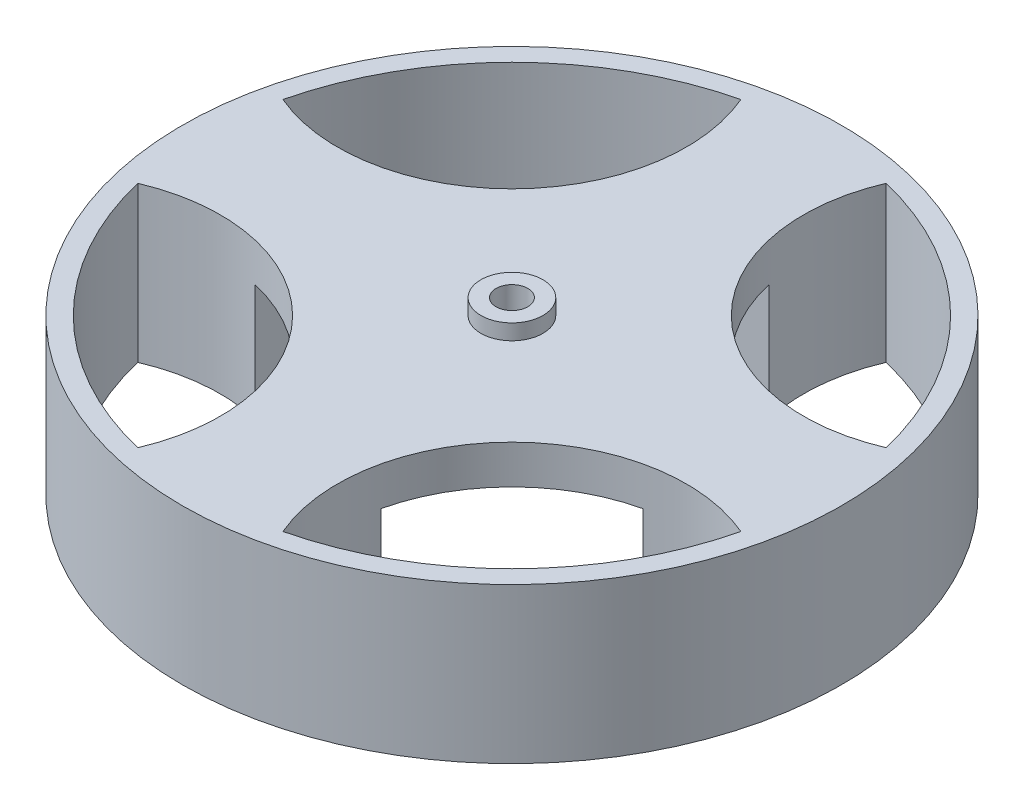
from build123d import *

# Parameters (mm, degrees)
SKETCH1_R           = 42.5
SKETCH1_R_2         = 40
BOSS_EXTRUDE1_DEPTH = 10
BOSS_EXTRUDE2_START = -5
BOSS_EXTRUDE2_DEPTH = 5
SKETCH3_R           = 4
SKETCH3_R_2         = 2.05
BOSS_EXTRUDE3_DEPTH = 2
SKETCH4_R           = 2.05
CUT_EXTRUDE1_DEPTH  = 64.344297297
BOSS_EXTRUDE4_START = 15
BOSS_EXTRUDE4_DEPTH = 15


with BuildPart() as part:
    # Sketch1 → Boss-Extrude1 (new, symmetric)
    with BuildSketch(Plane(origin=(0, 0, 0), x_dir=(1, 0, 0), z_dir=(0, 1, 0))):
        with Locations(Location((0, 0, 0), (0, 0, 270))):
            Circle(SKETCH1_R)
        with Locations(Location((0, 0, 0), (0, 0, 270))):
            Circle(SKETCH1_R_2, mode=Mode.SUBTRACT)
    extrude(amount=BOSS_EXTRUDE1_DEPTH, both=True)

    # Sketch2 → Boss-Extrude2 (add)
    with BuildSketch(Plane(origin=(0, 10, 0), x_dir=(1, 0, 0), z_dir=(0, 1, 0)).offset(BOSS_EXTRUDE2_START)):
        with BuildLine():
            ThreePointArc((-38.889408297, 9.36023089), (-14.142135624, 14.142135624), (-9.36023089, 38.889408297))
            ThreePointArc((-9.36023089, 38.889408297), (0, 40), (9.36023089, 38.889408297))
            ThreePointArc((9.36023089, 38.889408297), (14.142135624, 14.142135624), (38.889408297, 9.36023089))
            ThreePointArc((38.889408297, 9.36023089), (40, 0), (38.889408297, -9.36023089))
            ThreePointArc((38.889408297, -9.36023089), (14.142135624, -14.142135624), (9.36023089, -38.889408297))
            ThreePointArc((9.36023089, -38.889408297), (0, -40), (-9.36023089, -38.889408297))
            ThreePointArc((-9.36023089, -38.889408297), (-14.142135624, -14.142135624), (-38.889408297, -9.36023089))
            ThreePointArc((-38.889408297, -9.36023089), (-40, 0), (-38.889408297, 9.36023089))
        make_face()
    extrude(amount=BOSS_EXTRUDE2_DEPTH)

    # Sketch3 → Boss-Extrude3 (add)
    with BuildSketch(Plane(origin=(0, 10, 0), x_dir=(1, 0, 0), z_dir=(0, 1, 0))):
        with Locations(Location((0, 0, 0), (0, 0, 270))):
            Circle(SKETCH3_R)
        with Locations(Location((0, 0, 0), (0, 0, 270))):
            Circle(SKETCH3_R_2, mode=Mode.SUBTRACT)
    extrude(amount=BOSS_EXTRUDE3_DEPTH)

    # Sketch4 → Cut-Extrude1 (cut, through all)
    with BuildSketch(Plane(origin=(0, 10, 0), x_dir=(1, 0, 0), z_dir=(0, 1, 0))):
        with Locations(Location((0, 0, 0), (0, 0, 270))):
            Circle(SKETCH4_R)
    extrude(amount=-CUT_EXTRUDE1_DEPTH, mode=Mode.SUBTRACT)

    # Sketch5 → Boss-Extrude4 (add)
    with BuildSketch(Plane.XZ.offset(-5).offset(BOSS_EXTRUDE4_START)):
        with BuildLine():
            Line((-25, -8.126552801), (-25, 8.126552801))
            ThreePointArc((-25, 8.126552801), (-32.042685029, 7.64027064), (-38.889408297, 9.36023089))
            ThreePointArc((-38.889408297, 9.36023089), (-40, 0), (-38.889408297, -9.36023089))
            ThreePointArc((-38.889408297, -9.36023089), (-32.042685029, -7.64027064), (-25, -8.126552801))
        make_face()
        with BuildLine():
            Line((-8.126552801, 25), (8.126552801, 25))
            ThreePointArc((8.126552801, 25), (7.64027064, 32.042685029), (9.36023089, 38.889408297))
            ThreePointArc((9.36023089, 38.889408297), (0, 40), (-9.36023089, 38.889408297))
            ThreePointArc((-9.36023089, 38.889408297), (-7.64027064, 32.042685029), (-8.126552801, 25))
        make_face()
        with BuildLine():
            Line((25, 8.126552801), (25, -8.126552801))
            ThreePointArc((25, -8.126552801), (32.042685029, -7.64027064), (38.889408297, -9.36023089))
            ThreePointArc((38.889408297, -9.36023089), (40, 0), (38.889408297, 9.36023089))
            ThreePointArc((38.889408297, 9.36023089), (32.042685029, 7.64027064), (25, 8.126552801))
        make_face()
        with BuildLine():
            Line((8.126552801, -25), (-8.126552801, -25))
            ThreePointArc((-8.126552801, -25), (-7.64027064, -32.042685029), (-9.36023089, -38.889408297))
            ThreePointArc((-9.36023089, -38.889408297), (0, -40), (9.36023089, -38.889408297))
            ThreePointArc((9.36023089, -38.889408297), (7.64027064, -32.042685029), (8.126552801, -25))
        make_face()
    extrude(amount=-BOSS_EXTRUDE4_DEPTH)


solid = part.part
